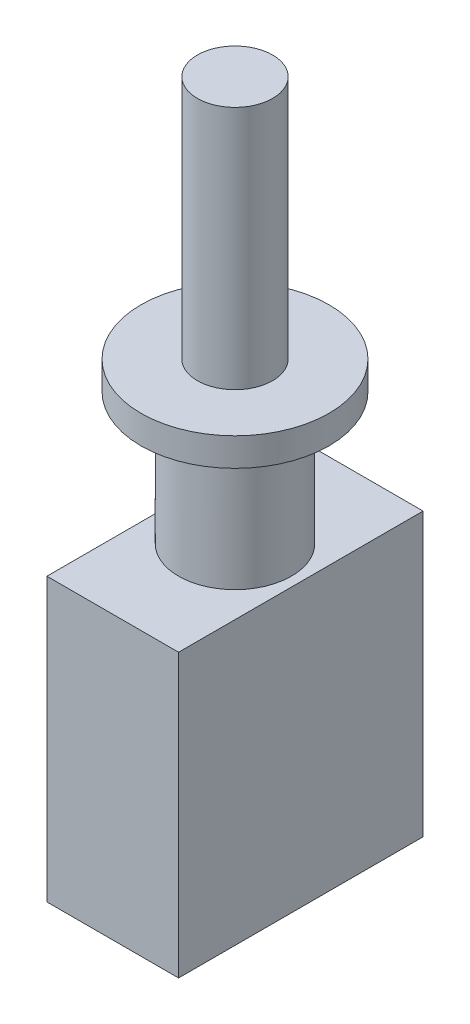
from build123d import *

# Parameters (mm, degrees)
ESQUISSE1_W      = 7
ESQUISSE1_H      = 13
EXTRUSION1_DEPTH = 15
ESQUISSE2_R      = 3
EXTRUSION2_DEPTH = 7
ESQUISSE3_R      = 5
EXTRUSION3_DEPTH = 1.5
ESQUISSE4_R      = 2
EXTRUSION4_DEPTH = 13


with BuildPart() as part:
    # Esquisse1 → Extrusion1 (new body)
    with BuildSketch(Plane(origin=(0, 0, 0), x_dir=(1, 0, 0), z_dir=(0, 1, 0))):
        Rectangle(ESQUISSE1_W, ESQUISSE1_H)
    extrude(amount=EXTRUSION1_DEPTH)

    # Esquisse2 → Extrusion2 (add)
    with BuildSketch(Plane(origin=(0, 15, 0), x_dir=(-1, 0, 0), z_dir=(0, 1, 0))):
        with Locations(Location((0, 0, 0), (0, 0, 270))):
            Circle(ESQUISSE2_R)
    extrude(amount=EXTRUSION2_DEPTH)

    # Esquisse3 → Extrusion3 (add)
    with BuildSketch(Plane(origin=(0, 22, 0), x_dir=(-1, 0, 0), z_dir=(0, 1, 0))):
        with Locations(Location((0, 0, 0), (0, 0, 90))):
            Circle(ESQUISSE3_R)
    extrude(amount=EXTRUSION3_DEPTH)

    # Esquisse4 → Extrusion4 (add)
    with BuildSketch(Plane(origin=(0, 23.5, 0), x_dir=(-1, 0, 0), z_dir=(0, 1, 0))):
        with Locations(Location((0, 0, 0), (0, 0, 270))):
            Circle(ESQUISSE4_R)
    extrude(amount=EXTRUSION4_DEPTH)


solid = part.part
